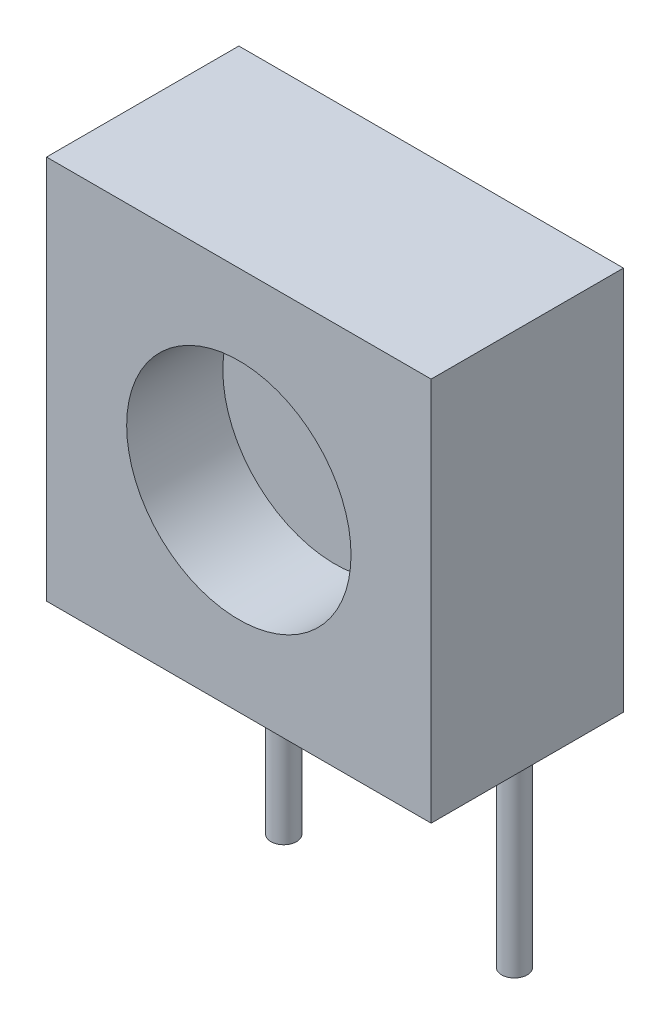
from build123d import *

# Parameters (mm, degrees)
SKETCH1_W           = 6
SKETCH1_H           = 6
SKETCH1_R           = 1.75
BOSS_EXTRUDE1_DEPTH = 3
SKETCH2_W           = 6
SKETCH2_H           = 6
BOSS_EXTRUDE2_DEPTH = 1.5
SKETCH3_R           = 0.2
BOSS_EXTRUDE3_DEPTH = 3.8


with BuildPart() as part:
    # Sketch1 → Boss-Extrude1 (new body)
    with BuildSketch(Plane.XY):
        with Locations((3, 3)):
            Rectangle(SKETCH1_W, SKETCH1_H)
        with Locations((3, 3)):
            Circle(SKETCH1_R, mode=Mode.SUBTRACT)
    extrude(amount=BOSS_EXTRUDE1_DEPTH)

    # Sketch2 → Boss-Extrude2 (add)
    with BuildSketch(Plane.XY):
        with Locations((3, 3)):
            Rectangle(SKETCH2_W, SKETCH2_H)
    extrude(amount=BOSS_EXTRUDE2_DEPTH)

    # Sketch3 → Boss-Extrude3 (add)
    with BuildSketch(Plane.XZ):
        with Locations(Location((1.2, 0.5, 0), (0, 0, 90))):
            Circle(SKETCH3_R)
        with Locations(Location((4.8, 0.5, 0), (0, 0, 90))):
            Circle(SKETCH3_R)
    extrude(amount=BOSS_EXTRUDE3_DEPTH)


solid = part.part
